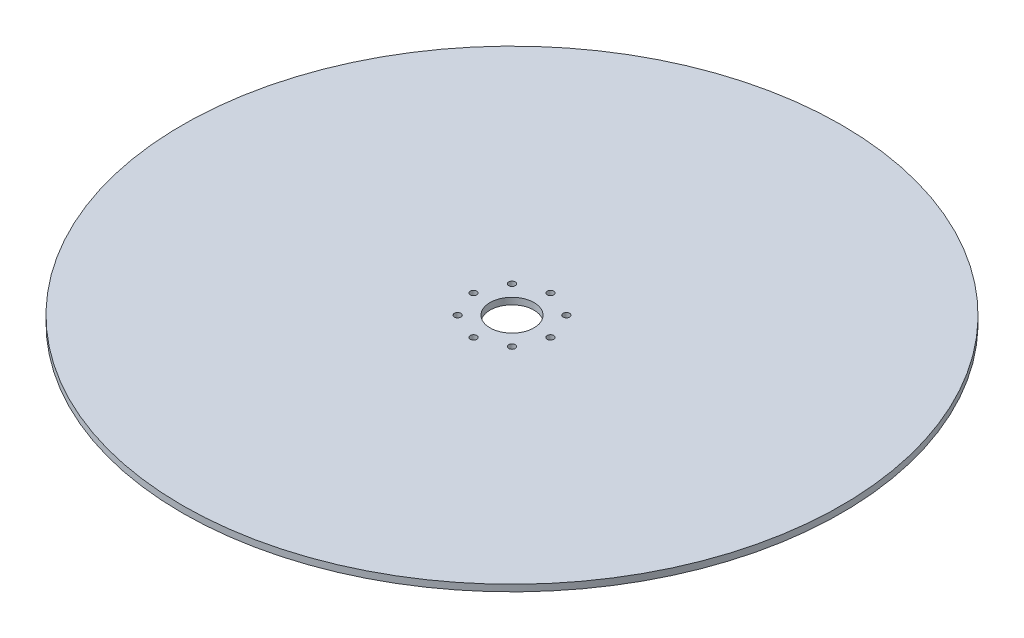
from build123d import *

# Parameters (mm, degrees)
SKETCH_1_R      = 150
SKETCH_1_R_2    = 10
SKETCH_1_R_3    = 1.5
EXTRUDE_1_DEPTH = 3


with BuildPart() as part:
    # 草图1 → 凸台-拉伸1 (new body)
    with BuildSketch(Plane(origin=(0, 0, 0), x_dir=(1, 0, 0), z_dir=(0, 1, 0))):
        with Locations(Location((0, 0, 0), (0, 0, 270))):
            Circle(SKETCH_1_R)
        with Locations(Location((0, 0, 0), (0, 0, 270))):
            Circle(SKETCH_1_R_2, mode=Mode.SUBTRACT)
        with Locations(Location((12.374368671, 12.374368671, 0), (0, 0, 270))):
            Circle(SKETCH_1_R_3, mode=Mode.SUBTRACT)
        with Locations(Location((-12.374368671, 12.374368671, 0), (0, 0, 90))):
            Circle(SKETCH_1_R_3, mode=Mode.SUBTRACT)
        with Locations(Location((0, 17.5, 0), (0, 0, 270))):
            Circle(SKETCH_1_R_3, mode=Mode.SUBTRACT)
        with Locations(Location((17.5, 0, 0), (0, 0, 270))):
            Circle(SKETCH_1_R_3, mode=Mode.SUBTRACT)
        with Locations(Location((12.374368671, -12.374368671, 0), (0, 0, 90))):
            Circle(SKETCH_1_R_3, mode=Mode.SUBTRACT)
        with Locations(Location((0, -17.5, 0), (0, 0, 90))):
            Circle(SKETCH_1_R_3, mode=Mode.SUBTRACT)
        with Locations(Location((-12.374368671, -12.374368671, 0), (0, 0, 270))):
            Circle(SKETCH_1_R_3, mode=Mode.SUBTRACT)
        with Locations(Location((-17.5, 0, 0), (0, 0, 90))):
            Circle(SKETCH_1_R_3, mode=Mode.SUBTRACT)
    extrude(amount=EXTRUDE_1_DEPTH)


solid = part.part
